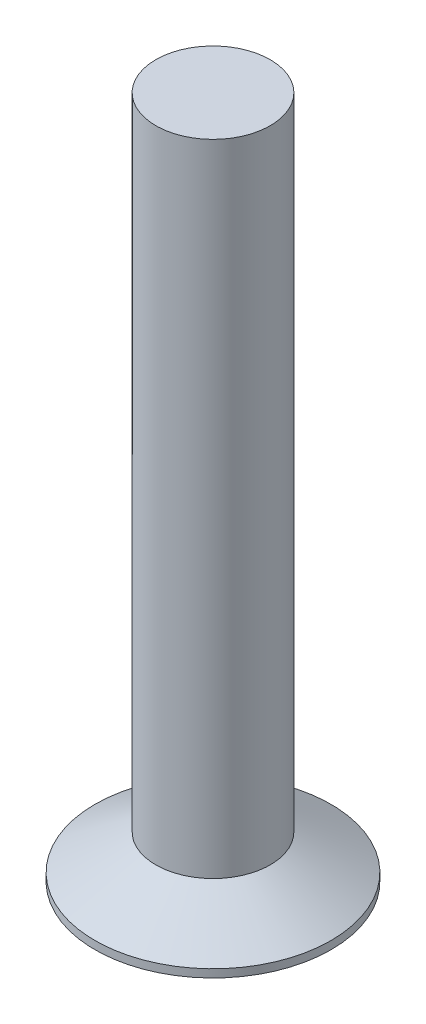
from build123d import *


with BuildPart() as part:
    # Sketch1 → Revolve1 (revolve)
    with BuildSketch(Plane.XY):
        Polygon((0.009374143, -37.147536967), (-14.740625857, -37.147536967), (-14.740625857, -36.147536967), (-7.140625857, -31.759674921), (-7.140625857, 48.240325079), (0.009374143, 48.240325079), (0.009374143, -31.967159679), align=None)
    revolve(axis=Axis((0.009374143, 4.359912343, 0), (0, -1, 0)))


solid = part.part
